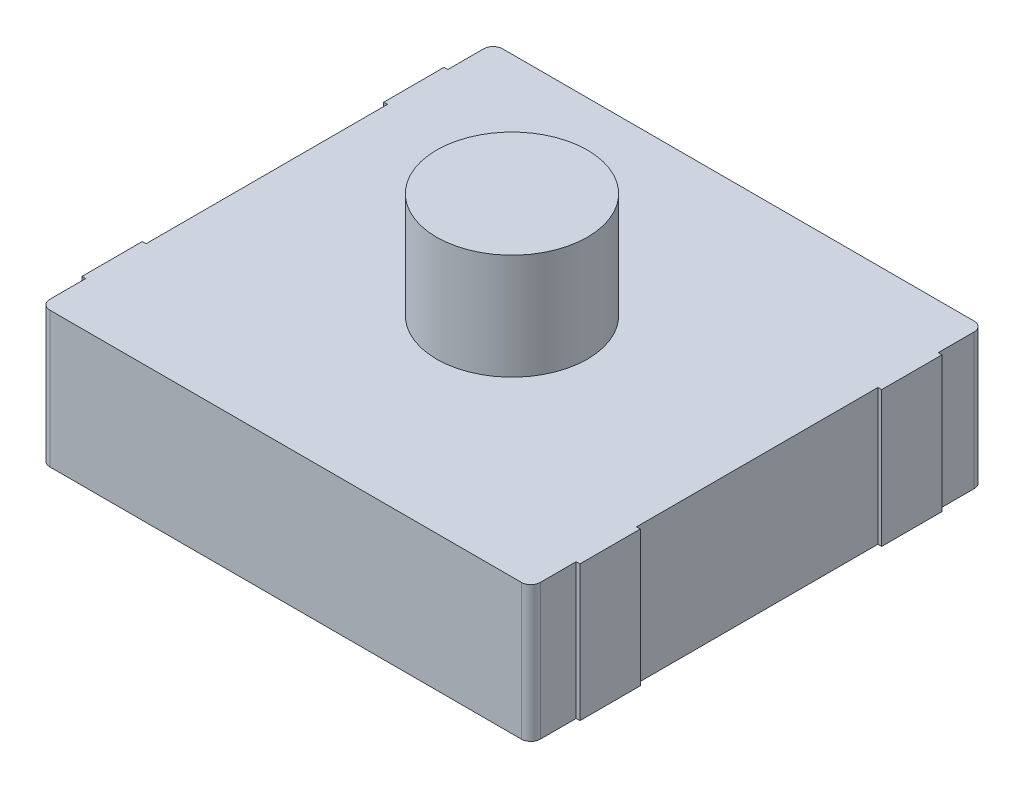
from build123d import *

# Parameters (mm, degrees)
SKETCH1_W           = 6.5
SKETCH1_H           = 6
BOSS_EXTRUDE1_DEPTH = 1.8
SKETCH2_W           = 1
SKETCH2_H           = 0.8
BOSS_EXTRUDE2_DEPTH = 1.8
SKETCH3_R           = 1
BOSS_EXTRUDE3_DEPTH = 1.4
FILLET1_R           = 0.125


with BuildPart() as part:
    # Sketch1 → Boss-Extrude1 (new body)
    with BuildSketch(Plane(origin=(0, 0, 0), x_dir=(1, 0, 0), z_dir=(0, 1, 0))):
        Rectangle(SKETCH1_W, SKETCH1_H)
    extrude(amount=BOSS_EXTRUDE1_DEPTH)

    # Sketch2 → Boss-Extrude2 (add)
    with BuildSketch(Plane.XZ):
        with Locations((-2.8, 2)):
            Rectangle(SKETCH2_W, SKETCH2_H)
        with Locations((-2.8, -2)):
            Rectangle(SKETCH2_W, SKETCH2_H)
        with Locations((2.8, -2)):
            Rectangle(SKETCH2_W, SKETCH2_H)
        with Locations((2.8, 2)):
            Rectangle(SKETCH2_W, SKETCH2_H)
    extrude(amount=-BOSS_EXTRUDE2_DEPTH)

    # Sketch3 → Boss-Extrude3 (add)
    with BuildSketch(Plane(origin=(0, 1.8, 0), x_dir=(1, 0, 0), z_dir=(0, 1, 0))):
        with Locations(Location((0, 0, 0), (0, 0, 270))):
            Circle(SKETCH3_R)
    extrude(amount=BOSS_EXTRUDE3_DEPTH)

    # Fillet1
    fillet1_edges = [part.edges().sort_by_distance(p)[0] for p in [
        (-3.25, 0.9, -3),
        (3.25, 0.9, -3),
        (3.25, 0.9, 3),
        (-3.25, 0.9, 3),
    ]]
    fillet(fillet1_edges, radius=FILLET1_R)


solid = part.part
